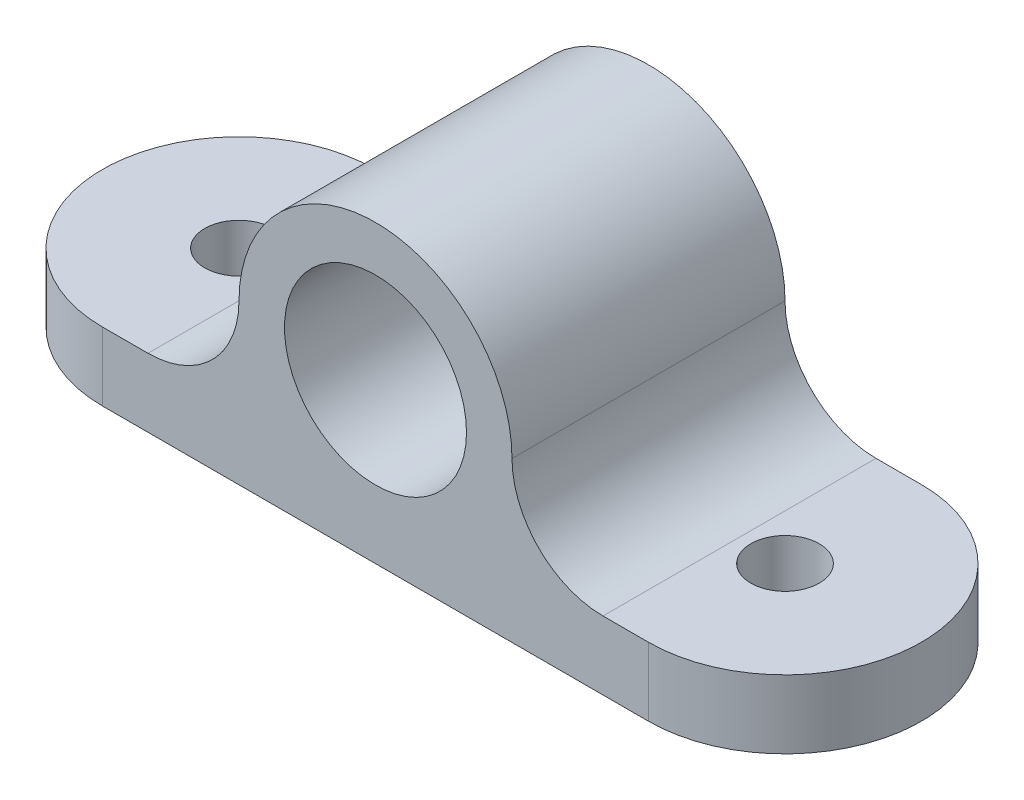
from build123d import *

# Parameters (mm, degrees)
BOSS_EXTRUDE1_DEPTH = 4.7752
SKETCH3_R           = 2.3876
CUT_EXTRUDE1_DEPTH  = 52.515489516
SKETCH4_W           = 19.05
SKETCH4_H           = 19.05
BOSS_EXTRUDE2_DEPTH = 15.8496
SKETCH5_R           = 6.35
CUT_EXTRUDE3_DEPTH  = 56.284948223
FILLET1_R           = 6.35
FILLET2_R           = 6.35


with BuildPart() as part:
    # Sketch1 → Boss-Extrude1 (new body)
    with BuildSketch(Plane(origin=(0, 0, 0), x_dir=(1, 0, 0), z_dir=(0, 1, 0))):
        with BuildLine():
            Line((0, 19.05), (38.1, 19.05))
            ThreePointArc((38.1, 19.05), (47.625, 9.525), (38.1, 0))
            Line((38.1, 0), (0, 0))
            ThreePointArc((0, 0), (-9.525, 9.525), (0, 19.05))
        make_face()
    extrude(amount=BOSS_EXTRUDE1_DEPTH)

    # Sketch3 → Cut-Extrude1 (cut, through all)
    with BuildSketch(Plane(origin=(0, 4.7752, 0), x_dir=(1, 0, 0), z_dir=(0, 1, 0))):
        with Locations(Location((38.1, 9.525, 0), (0, 0, 270))):
            Circle(SKETCH3_R)
        with Locations(Location((0, 9.525, 0), (0, 0, 270))):
            Circle(SKETCH3_R)
    extrude(amount=-CUT_EXTRUDE1_DEPTH, mode=Mode.SUBTRACT)

    # Sketch4 → Boss-Extrude2 (add)
    with BuildSketch(Plane(origin=(0, 4.7752, 0), x_dir=(1, 0, 0), z_dir=(0, 1, 0))):
        with Locations((19.05, 9.525)):
            Rectangle(SKETCH4_W, SKETCH4_H)
    extrude(amount=BOSS_EXTRUDE2_DEPTH)

    # Sketch5 → Cut-Extrude3 (cut, through all)
    with BuildSketch(Plane.XY):
        with BuildLine():
            ThreePointArc((19.05, 20.6248), (25.785192091, 17.834992091), (28.575, 11.0998))
            Line((28.575, 11.0998), (28.575, 20.6248))
            Line((28.575, 20.6248), (19.05, 20.6248))
        make_face()
        with BuildLine():
            ThreePointArc((9.525, 11.0998), (12.314807909, 17.834992091), (19.05, 20.6248))
            Line((19.05, 20.6248), (9.525, 20.6248))
            Line((9.525, 20.6248), (9.525, 11.0998))
        make_face()
        with Locations((19.05, 11.0998)):
            Circle(SKETCH5_R)
    extrude(amount=-CUT_EXTRUDE3_DEPTH, mode=Mode.SUBTRACT)

    # Fillet1
    fillet1_edges = [part.edges().sort_by_distance(p)[0] for p in [
        (28.575, 4.7752, -9.525),
    ]]
    fillet(fillet1_edges, radius=FILLET1_R)

    # Fillet2
    fillet2_edges = [part.edges().sort_by_distance(p)[0] for p in [
        (9.525, 4.7752, -9.525),
    ]]
    fillet(fillet2_edges, radius=FILLET2_R)


solid = part.part
